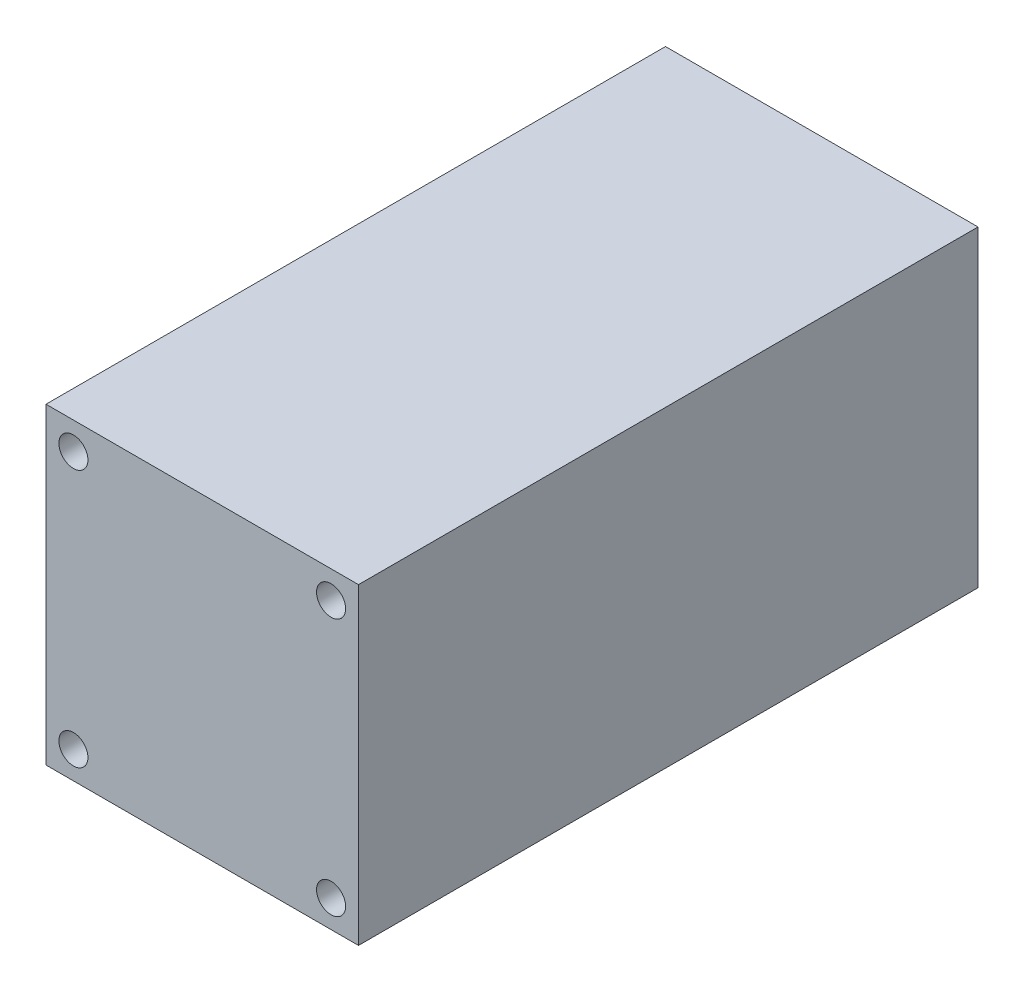
from build123d import *

# Parameters (mm, degrees)
SKETCH1_W           = 57
SKETCH1_H           = 57
SKETCH1_R           = 2.65
BOSS_EXTRUDE1_DEPTH = 113
SKETCH2_R           = 19.075
BOSS_EXTRUDE2_DEPTH = 1.6
SKETCH3_R           = 5
BOSS_EXTRUDE3_DEPTH = 22.4


with BuildPart() as part:
    # Sketch1 → Boss-Extrude1 (new body)
    with BuildSketch(Plane.XY):
        Rectangle(SKETCH1_W, SKETCH1_H)
        with Locations((-23.5, 23.5)):
            Circle(SKETCH1_R, mode=Mode.SUBTRACT)
        with Locations((23.5, 23.5)):
            Circle(SKETCH1_R, mode=Mode.SUBTRACT)
        with Locations((23.5, -23.5)):
            Circle(SKETCH1_R, mode=Mode.SUBTRACT)
        with Locations((-23.5, -23.5)):
            Circle(SKETCH1_R, mode=Mode.SUBTRACT)
    extrude(amount=BOSS_EXTRUDE1_DEPTH)

    # Sketch2 → Boss-Extrude2 (add)
    with BuildSketch(Plane.XY):
        Circle(SKETCH2_R)
    extrude(amount=-BOSS_EXTRUDE2_DEPTH)

    # Sketch3 → Boss-Extrude3 (add)
    with BuildSketch(Plane.XY):
        Circle(SKETCH3_R)
    extrude(amount=-BOSS_EXTRUDE3_DEPTH)


solid = part.part
